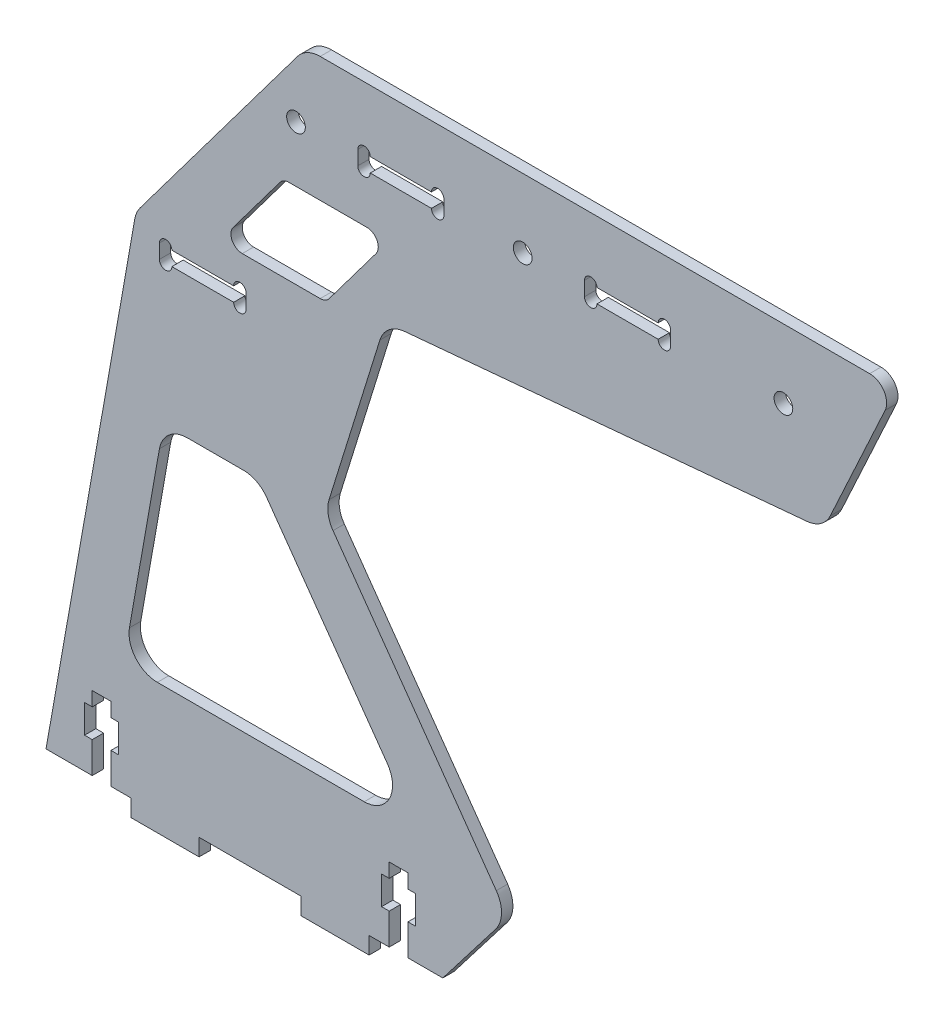
from build123d import *

# Parameters (mm, degrees)
EXTRUDE_1_DEPTH      = 2
CUT_EXTRUDE_1_DEPTH  = 2
EXTRUDE_2_DEPTH      = 2
SKETCH_6_W           = 3.3
SKETCH_6_H           = 13
CUT_EXTRUDE_3_DEPTH  = 2
SKETCH_7_W           = 6
SKETCH_7_H           = 5
CUT_EXTRUDE_4_DEPTH  = 2
CUT_EXTRUDE_5_DEPTH  = 2
CUT_EXTRUDE_7_DEPTH  = 10
CUT_EXTRUDE_9_DEPTH  = 10
FILLET_1_R           = 5
CUT_EXTRUDE_10_DEPTH = 50
SKETCH_13_R          = 1.65
CUT_EXTRUDE_11_DEPTH = 50
FILLET_2_R           = 5
CUT_EXTRUDE_13_DEPTH = 50
FILLET_4_R           = 2
FILLET_5_R           = 3


with BuildPart() as part:
    # 草图1 → 凸台-拉伸1 (new body)
    with BuildSketch(Plane.XY):
        Polygon((-20, -65), (-35, -65), (-35, 65), (35, 65), (35, -65), (22, -65), (22, -68), (10, -68), (10, -65), (-8, -65), (-8, -68), (-20, -68), align=None)
    extrude(amount=EXTRUDE_1_DEPTH)

    # 草图2 → 切除-拉伸1 (cut)
    with BuildSketch(Plane.XY.offset(2)):
        Polygon((-35, -65), (-19.130571736, 25), (10.869428264, 65), (-35, 65), align=None)
    extrude(amount=-CUT_EXTRUDE_1_DEPTH, mode=Mode.SUBTRACT)

    # 草图3 → 凸台-拉伸2 (add)
    with BuildSketch(Plane.XY.offset(2)):
        Polygon((35, 65), (115, 65), (85, 0), (35, -65), align=None)
    extrude(amount=-EXTRUDE_2_DEPTH)

    # 草图6 → 切除-拉伸3 (cut)
    with BuildSketch(Plane.XY.offset(2)):
        with Locations((-25.2, -58.5)):
            Rectangle(SKETCH_6_W, SKETCH_6_H)
        with Locations((27.2, -58.5)):
            Rectangle(SKETCH_6_W, SKETCH_6_H)
    extrude(amount=-CUT_EXTRUDE_3_DEPTH, mode=Mode.SUBTRACT)

    # 草图7 → 切除-拉伸4 (cut)
    with BuildSketch(Plane.XY.offset(2)):
        with Locations((-25.2, -57)):
            Rectangle(SKETCH_7_W, SKETCH_7_H)
        with Locations((27.2, -57)):
            Rectangle(SKETCH_7_W, SKETCH_7_H)
    extrude(amount=-CUT_EXTRUDE_4_DEPTH, mode=Mode.SUBTRACT)

    # 草图8 → 切除-拉伸5 (cut)
    with BuildSketch(Plane.XY.offset(2)):
        Polygon((46.581829906, -49.943621123), (14.201899011, -4.308455167), (24.89214771, 30.117769456), (102.152743187, 37.164276905), (85, 0), align=None)
    extrude(amount=-CUT_EXTRUDE_5_DEPTH, mode=Mode.SUBTRACT)

    # 草图9 → 切除-拉伸7 (cut)
    with BuildSketch(Plane.XY.offset(2)):
        with BuildLine():
            Line((-12.8, 19.8), (-1.9, 19.8))
            ThreePointArc((-1.9, 19.8), (-0.8, 18.7), (0.3, 19.8))
            Line((0.3, 19.8), (0.3, 22.3))
            ThreePointArc((0.3, 22.3), (-0.8, 23.4), (-1.9, 22.3))
            Line((-1.9, 22.3), (-12.8, 22.3))
            ThreePointArc((-12.8, 22.3), (-13.9, 23.4), (-15, 22.3))
            Line((-15, 22.3), (-15, 19.8))
            ThreePointArc((-15, 19.8), (-13.9, 18.7), (-12.8, 19.8))
        make_face()
    extrude(amount=-CUT_EXTRUDE_7_DEPTH, mode=Mode.SUBTRACT)

    # 草图11 → 切除-拉伸9 (cut)
    with BuildSketch(Plane(origin=(0, 0, 0), x_dir=(-1, 0, 0), z_dir=(0, 0, -1))):
        Polygon((-2.431069725, -5), (-30.812630494, -45), (21.319194267, -45), (14.266115039, -5), align=None)
    extrude(amount=-CUT_EXTRUDE_9_DEPTH, mode=Mode.SUBTRACT)

    # 圆角1
    fillet_1_edges = [part.edges().sort_by_distance(p)[0] for p in [
        (46.581829906, -49.943621123, 1),
        (14.201899011, -4.308455167, 1),
        (24.89214771, 30.117769456, 1),
        (2.431069725, -5, 1),
        (-14.266115039, -5, 1),
        (-21.319194267, -45, 1),
        (30.812630494, -45, 1),
    ]]
    fillet(fillet_1_edges, radius=FILLET_1_R)

    # 草图12 → 切除-拉伸10 (cut)
    with BuildSketch(Plane.XY.offset(2)):
        with BuildLine():
            Line((22.2, 54.1), (33, 54.1))
            ThreePointArc((33, 54.1), (34.1, 55.2), (35.2, 54.1))
            Line((35.2, 54.1), (35.2, 51.6))
            ThreePointArc((35.2, 51.6), (34.1, 50.5), (33, 51.6))
            Line((33, 51.6), (22.2, 51.6))
            ThreePointArc((22.2, 51.6), (21.1, 50.5), (20, 51.6))
            Line((20, 51.6), (20, 54.1))
            ThreePointArc((20, 54.1), (21.1, 55.2), (22.2, 54.1))
        make_face()
        with BuildLine():
            Line((62.2, 51.6), (73, 51.6))
            ThreePointArc((73, 51.6), (74.1, 50.5), (75.2, 51.6))
            Line((75.2, 51.6), (75.2, 54.1))
            ThreePointArc((75.2, 54.1), (74.1, 55.2), (73, 54.1))
            Line((73, 54.1), (62.2, 54.1))
            ThreePointArc((62.2, 54.1), (61.1, 55.2), (60, 54.1))
            Line((60, 54.1), (60, 51.6))
            ThreePointArc((60, 51.6), (61.1, 50.5), (62.2, 51.6))
        make_face()
    extrude(amount=-CUT_EXTRUDE_10_DEPTH, mode=Mode.SUBTRACT)

    # 草图13 → 切除-拉伸11 (cut)
    with BuildSketch(Plane.XY.offset(2)):
        with Locations((9.1, 52.85)):
            Circle(SKETCH_13_R)
        with Locations((49.1, 52.85)):
            Circle(SKETCH_13_R)
        with Locations((95.1, 52.85)):
            Circle(SKETCH_13_R)
    extrude(amount=-CUT_EXTRUDE_11_DEPTH, mode=Mode.SUBTRACT)

    # 圆角2
    fillet_2_edges = [part.edges().sort_by_distance(p)[0] for p in [
        (102.152743187, 37.164276905, 1),
        (10.869428264, 65, 1),
        (-19.130571736, 25, 1),
    ]]
    fillet(fillet_2_edges, radius=FILLET_2_R)

    # 草图15 → 切除-拉伸13 (cut)
    with BuildSketch(Plane.XY.offset(2)):
        Polygon((6.869428264, 43), (-4.380571736, 28), (14.369428264, 28), (25.619428264, 43), align=None)
    extrude(amount=-CUT_EXTRUDE_13_DEPTH, mode=Mode.SUBTRACT)

    # 圆角4
    fillet_4_edges = [part.edges().sort_by_distance(p)[0] for p in [
        (6.869428264, 43, 1),
        (25.619428264, 43, 1),
        (14.369428264, 28, 1),
        (-4.380571736, 28, 1),
    ]]
    fillet(fillet_4_edges, radius=FILLET_4_R)

    # 圆角5
    fillet_5_edges = [part.edges().sort_by_distance(p)[0] for p in [
        (115, 65, 1),
    ]]
    fillet(fillet_5_edges, radius=FILLET_5_R)


solid = part.part
